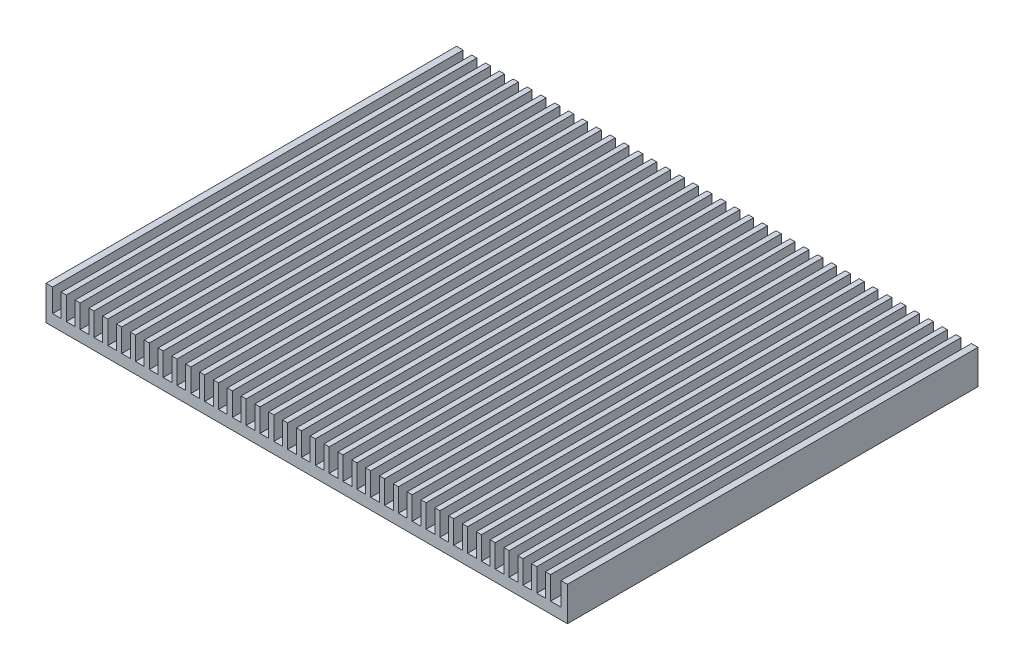
from build123d import *

# Parameters (mm, degrees)
SKETCH_1_W      = 1.6
SKETCH_1_H      = 5.6
SKETCH_1_W_2    = 1.25
EXTRUDE_1_DEPTH = 100


with BuildPart() as part:
    # 草图1 → 凸台-拉伸1 (new body)
    with BuildSketch(Plane.XY):
        Polygon((-63.5, 1.710790235), (-63.5, -0.999209765), (63.5, -0.999209765), (63.5, 1.710790235), (61.9, 1.710790235), (59.4, 1.710790235), (58.15, 1.710790235), (56.03, 1.710790235), (54.78, 1.710790235), (52.66, 1.710790235), (51.41, 1.710790235), (49.29, 1.710790235), (48.04, 1.710790235), (45.92, 1.710790235), (44.67, 1.710790235), (42.55, 1.710790235), (41.3, 1.710790235), (39.18, 1.710790235), (37.93, 1.710790235), (35.81, 1.710790235), (34.56, 1.710790235), (32.44, 1.710790235), (31.19, 1.710790235), (29.07, 1.710790235), (27.82, 1.710790235), (25.7, 1.710790235), (24.45, 1.710790235), (22.33, 1.710790235), (21.08, 1.710790235), (18.96, 1.710790235), (17.71, 1.710790235), (15.59, 1.710790235), (14.34, 1.710790235), (12.22, 1.710790235), (10.97, 1.710790235), (8.85, 1.710790235), (7.6, 1.710790235), (5.48, 1.710790235), (4.23, 1.710790235), (2.11, 1.710790235), (0.86, 1.710790235), (-1.26, 1.710790235), (-2.51, 1.710790235), (-4.63, 1.710790235), (-5.88, 1.710790235), (-8, 1.710790235), (-9.25, 1.710790235), (-11.37, 1.710790235), (-12.62, 1.710790235), (-14.74, 1.710790235), (-15.99, 1.710790235), (-18.11, 1.710790235), (-19.36, 1.710790235), (-21.48, 1.710790235), (-22.73, 1.710790235), (-24.85, 1.710790235), (-26.1, 1.710790235), (-28.22, 1.710790235), (-29.47, 1.710790235), (-31.59, 1.710790235), (-32.84, 1.710790235), (-34.96, 1.710790235), (-36.21, 1.710790235), (-38.33, 1.710790235), (-39.58, 1.710790235), (-41.7, 1.710790235), (-42.95, 1.710790235), (-45.07, 1.710790235), (-46.32, 1.710790235), (-48.44, 1.710790235), (-49.69, 1.710790235), (-51.81, 1.710790235), (-53.06, 1.710790235), (-55.18, 1.710790235), (-56.43, 1.710790235), (-58.55, 1.710790235), (-59.8, 1.710790235), (-61.9, 1.710790235), align=None)
        with Locations((-62.7, 4.510790235)):
            Rectangle(SKETCH_1_W, SKETCH_1_H)
        with Locations((62.7, 4.510790235)):
            Rectangle(SKETCH_1_W, SKETCH_1_H)
        with Locations((-59.175, 4.510790235)):
            Rectangle(SKETCH_1_W_2, SKETCH_1_H)
        with Locations((58.775, 4.510790235)):
            Rectangle(SKETCH_1_W_2, SKETCH_1_H)
        with Locations((-55.805, 4.510790235)):
            Rectangle(SKETCH_1_W_2, SKETCH_1_H)
        with Locations((55.405, 4.510790235)):
            Rectangle(SKETCH_1_W_2, SKETCH_1_H)
        with Locations((-52.435, 4.510790235)):
            Rectangle(SKETCH_1_W_2, SKETCH_1_H)
        with Locations((52.035, 4.510790235)):
            Rectangle(SKETCH_1_W_2, SKETCH_1_H)
        with Locations((-49.065, 4.510790235)):
            Rectangle(SKETCH_1_W_2, SKETCH_1_H)
        with Locations((48.665, 4.510790235)):
            Rectangle(SKETCH_1_W_2, SKETCH_1_H)
        with Locations((-45.695, 4.510790235)):
            Rectangle(SKETCH_1_W_2, SKETCH_1_H)
        with Locations((45.295, 4.510790235)):
            Rectangle(SKETCH_1_W_2, SKETCH_1_H)
        with Locations((-42.325, 4.510790235)):
            Rectangle(SKETCH_1_W_2, SKETCH_1_H)
        with Locations((41.925, 4.510790235)):
            Rectangle(SKETCH_1_W_2, SKETCH_1_H)
        with Locations((-38.955, 4.510790235)):
            Rectangle(SKETCH_1_W_2, SKETCH_1_H)
        with Locations((38.555, 4.510790235)):
            Rectangle(SKETCH_1_W_2, SKETCH_1_H)
        with Locations((-35.585, 4.510790235)):
            Rectangle(SKETCH_1_W_2, SKETCH_1_H)
        with Locations((35.185, 4.510790235)):
            Rectangle(SKETCH_1_W_2, SKETCH_1_H)
        with Locations((-32.215, 4.510790235)):
            Rectangle(SKETCH_1_W_2, SKETCH_1_H)
        with Locations((31.815, 4.510790235)):
            Rectangle(SKETCH_1_W_2, SKETCH_1_H)
        with Locations((-28.845, 4.510790235)):
            Rectangle(SKETCH_1_W_2, SKETCH_1_H)
        with Locations((28.445, 4.510790235)):
            Rectangle(SKETCH_1_W_2, SKETCH_1_H)
        with Locations((-25.475, 4.510790235)):
            Rectangle(SKETCH_1_W_2, SKETCH_1_H)
        with Locations((25.075, 4.510790235)):
            Rectangle(SKETCH_1_W_2, SKETCH_1_H)
        with Locations((-22.105, 4.510790235)):
            Rectangle(SKETCH_1_W_2, SKETCH_1_H)
        with Locations((21.705, 4.510790235)):
            Rectangle(SKETCH_1_W_2, SKETCH_1_H)
        with Locations((-18.735, 4.510790235)):
            Rectangle(SKETCH_1_W_2, SKETCH_1_H)
        with Locations((18.335, 4.510790235)):
            Rectangle(SKETCH_1_W_2, SKETCH_1_H)
        with Locations((-15.365, 4.510790235)):
            Rectangle(SKETCH_1_W_2, SKETCH_1_H)
        with Locations((14.965, 4.510790235)):
            Rectangle(SKETCH_1_W_2, SKETCH_1_H)
        with Locations((-11.995, 4.510790235)):
            Rectangle(SKETCH_1_W_2, SKETCH_1_H)
        with Locations((11.595, 4.510790235)):
            Rectangle(SKETCH_1_W_2, SKETCH_1_H)
        with Locations((-8.625, 4.510790235)):
            Rectangle(SKETCH_1_W_2, SKETCH_1_H)
        with Locations((8.225, 4.510790235)):
            Rectangle(SKETCH_1_W_2, SKETCH_1_H)
        with Locations((-5.255, 4.510790235)):
            Rectangle(SKETCH_1_W_2, SKETCH_1_H)
        with Locations((4.855, 4.510790235)):
            Rectangle(SKETCH_1_W_2, SKETCH_1_H)
        with Locations((-1.885, 4.510790235)):
            Rectangle(SKETCH_1_W_2, SKETCH_1_H)
        with Locations((1.485, 4.510790235)):
            Rectangle(SKETCH_1_W_2, SKETCH_1_H)
    extrude(amount=EXTRUDE_1_DEPTH)


solid = part.part
